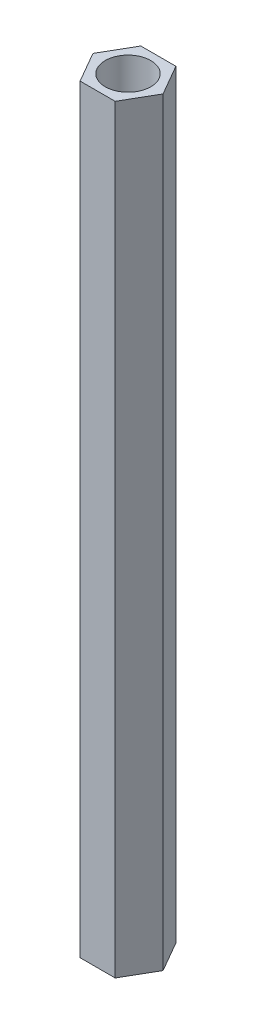
from build123d import *

# Parameters (mm, degrees)
EXTRUDE_1_DEPTH     = 50
SKETCH_2_R          = 1.5
CUT_EXTRUDE_1_DEPTH = 51.093246384


with BuildPart() as part:
    # 草图1 → 凸台-拉伸1 (new body)
    with BuildSketch(Plane(origin=(0, 0, 0), x_dir=(1, 0, 0), z_dir=(0, 1, 0))):
        Polygon((2.309401077, 0), (1.154700538, 2), (-1.154700538, 2), (-2.309401077, 0), (-1.154700538, -2), (1.154700538, -2), align=None)
    extrude(amount=EXTRUDE_1_DEPTH)

    # 草图2 → 切除-拉伸1 (cut, through all)
    with BuildSketch(Plane(origin=(0, 50, 0), x_dir=(1, 0, 0), z_dir=(0, 1, 0))):
        with Locations(Location((0, 0, 0), (0, 0, 270))):
            Circle(SKETCH_2_R)
    extrude(amount=-CUT_EXTRUDE_1_DEPTH, mode=Mode.SUBTRACT)


solid = part.part
